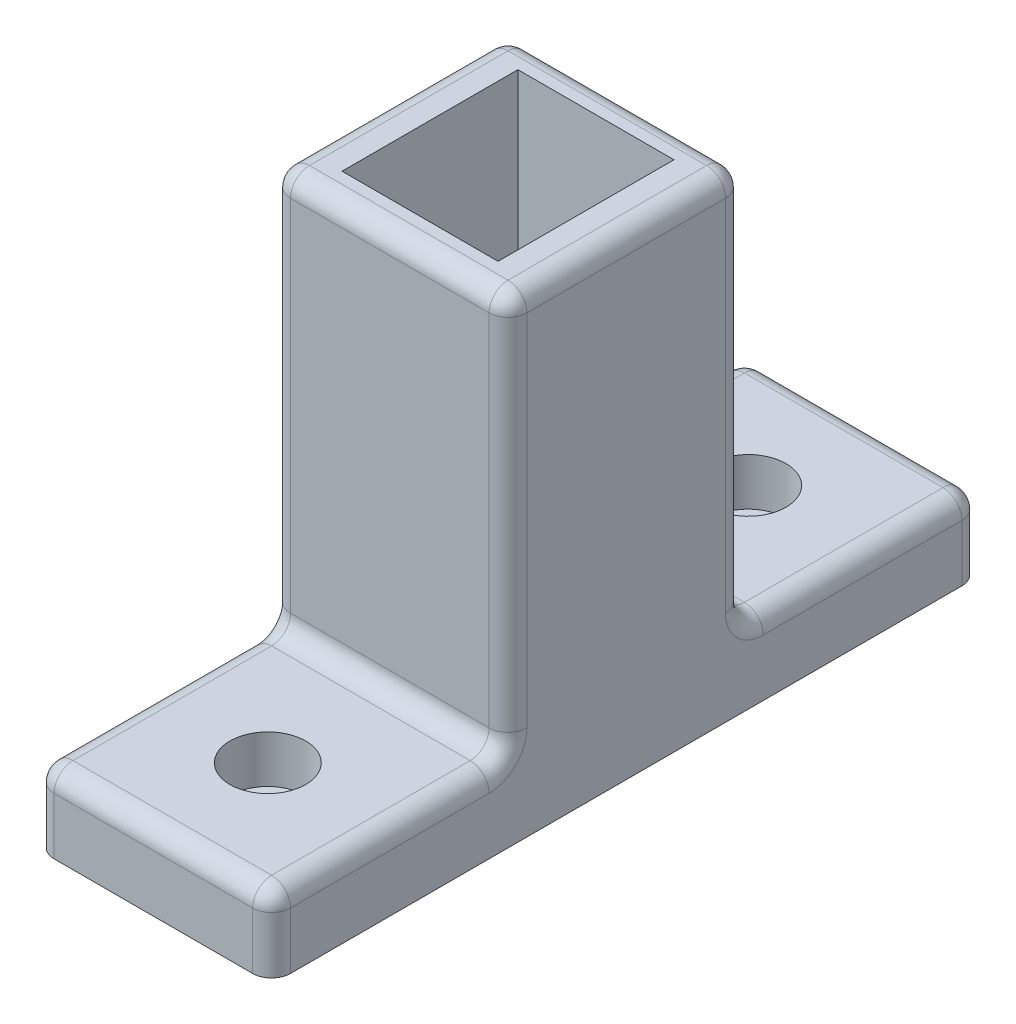
from build123d import *

# Parameters (mm, degrees)
SKETCH1_W               = 25
SKETCH1_H               = 25
SKETCH1_W_2             = 16.5
SKETCH1_H_2             = 18.6
BOSS_EXTRUDE1_DEPTH     = 50
SKETCH6_W               = 25
SKETCH6_H               = 75
BOSS_EXTRUDE3_DEPTH     = 8
FILLET2_R               = 2
SKETCH7_R               = 4
CUT_EXTRUDE1_DEPTH      = 5
CUT_EXTRUDE4_DEPTH      = 64.73774392
CUT_EXTRUDE4_DEPTH_BACK = 64.73774392
SKETCH8_R               = 2.38125


with BuildPart() as part:
    # Sketch1 → Boss-Extrude1 (new body)
    with BuildSketch(Plane(origin=(0, 0, 0), x_dir=(1, 0, 0), z_dir=(0, 1, 0))):
        Rectangle(SKETCH1_W, SKETCH1_H)
        Rectangle(SKETCH1_W_2, SKETCH1_H_2, mode=Mode.SUBTRACT)
    extrude(amount=BOSS_EXTRUDE1_DEPTH)

    # Sketch6 → Boss-Extrude3 (add)
    with BuildSketch(Plane(origin=(0, 0, 0), x_dir=(1, 0, 0), z_dir=(0, 1, 0))):
        Rectangle(SKETCH6_W, SKETCH6_H)
    extrude(amount=BOSS_EXTRUDE3_DEPTH)

    # Fillet2
    fillet2_edges = [part.edges().sort_by_distance(p)[0] for p in [
        (-12.5, 50, 0),
        (0, 50, 12.5),
        (12.5, 4, 37.5),
        (-12.5, 4, -37.5),
        (-12.5, 8, -25),
        (0, 8, -12.5),
        (12.5, 8, -25),
        (0, 8, -37.5),
        (12.5, 8, 25),
        (0, 8, 12.5),
        (-12.5, 8, 25),
        (0, 8, 37.5),
        (12.5, 4, -37.5),
        (-12.5, 4, 37.5),
        (12.5, 50, 0),
        (12.5, 29, 12.5),
        (-12.5, 29, 12.5),
        (-12.5, 29, -12.5),
        (12.5, 29, -12.5),
        (0, 50, -12.5),
    ]]
    fillet(fillet2_edges, radius=FILLET2_R)

    # Sketch7 → Cut-Extrude1 (cut)
    with BuildSketch(Plane(origin=(0, 8, 0), x_dir=(1, 0, 0), z_dir=(0, 1, 0))):
        with Locations(Location((0, 0, 0), (0, 0, 270))):
            Circle(SKETCH7_R)
        with Locations(Location((0, 25.4, 0), (0, 0, 270))):
            Circle(SKETCH7_R)
        with Locations(Location((0, -25.4, 0), (0, 0, 270))):
            Circle(SKETCH7_R)
    extrude(amount=-CUT_EXTRUDE1_DEPTH, mode=Mode.SUBTRACT)

    # Sketch8 → Cut-Extrude4 (cut, two sides: drawn at the far end of the back side and taken through both)
    with BuildSketch(Plane(origin=(0, 0, 0), x_dir=(1, 0, 0), z_dir=(0, 1, 0)).offset(-CUT_EXTRUDE4_DEPTH_BACK)):
        with Locations(Location((0, 0, 0), (0, 0, 270))):
            Circle(SKETCH8_R)
        with Locations(Location((0, 25.4, 0), (0, 0, 270))):
            Circle(SKETCH8_R)
        with Locations(Location((0, -25.4, 0), (0, 0, 270))):
            Circle(SKETCH8_R)
    extrude(amount=CUT_EXTRUDE4_DEPTH + CUT_EXTRUDE4_DEPTH_BACK, mode=Mode.SUBTRACT)


solid = part.part
